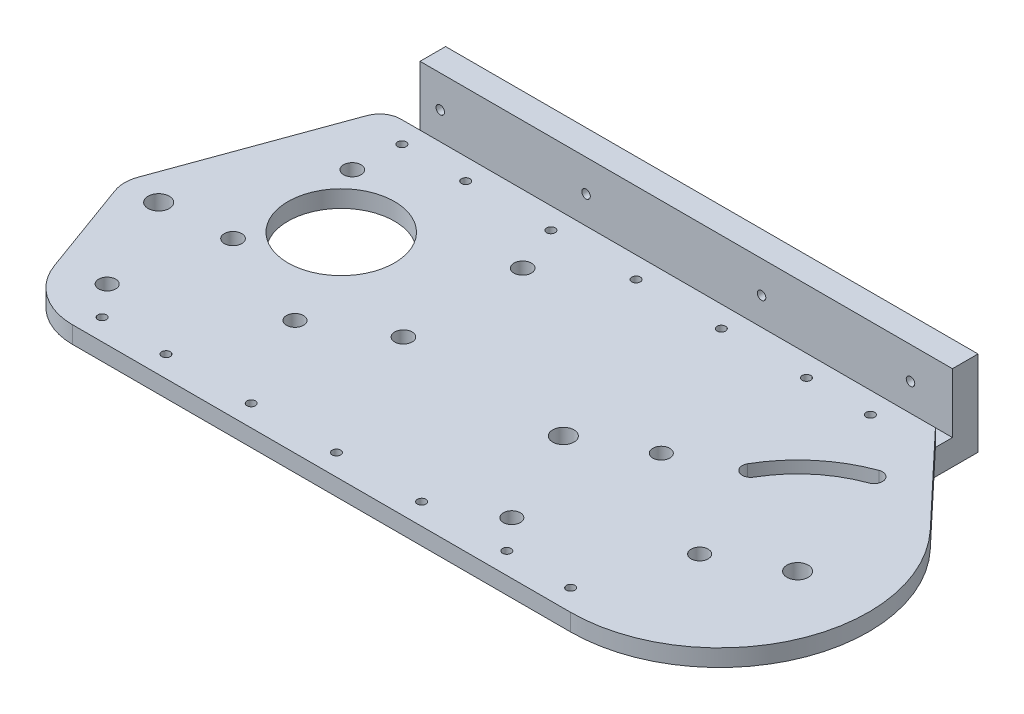
from build123d import *

# Parameters (mm, degrees)
SKETCH_1_R      = 2.5
SKETCH_1_R_2    = 2
SKETCH_1_R_3    = 2.05
SKETCH_1_R_4    = 12.5
SKETCH_1_R_5    = 1
EXTRUDE_1_DEPTH = 2
SCALE1_SCALE    = 2
EXTRUDE2_DEPTH  = 250
SKETCH5_R       = 2
EXTRUDE3_DEPTH  = 223.663658143
SKETCH6_R       = 2
EXTRUDE4_DEPTH  = 265.253658979


with BuildPart() as part:
    # 草图1 → 凸台-拉伸1 (new, symmetric)
    with BuildSketch(Plane(origin=(0, 0, 0), x_dir=(1, 0, 0), z_dir=(0, 1, 0))):
        with BuildLine():
            Line((-102.517540966, -2.736161147), (-94.366740219, -25.13030215))
            ThreePointArc((-94.366740219, -25.13030215), (-88.874997453, -32.287280664), (-80.271350907, -35))
            Line((-80.271350907, -35), (36.680057211, -35))
            ThreePointArc((36.680057211, -35), (68.818374627, -13.861044465), (62.135522738, 24.021225505))
            Line((62.135522738, 24.021225505), (42, 45.358983849))
            Line((42, 45.358983849), (-83.503064511, 45.358983849))
            ThreePointArc((-83.503064511, 45.358983849), (-86.370946693, 44.45474407), (-88.201527615, 42.069084565))
            Line((-88.201527615, 42.069084565), (-102.517540966, 2.736161147))
            ThreePointArc((-102.517540966, 2.736161147), (-103, 0), (-102.517540966, -2.736161147))
        make_face()
        with Locations(Location((-95, 0, 0), (0, 0, 270))):
            Circle(SKETCH_1_R, mode=Mode.SUBTRACT)
        with Locations(Location((0, 0, 0), (0, 0, 270))):
            Circle(SKETCH_1_R, mode=Mode.SUBTRACT)
        with Locations(Location((-84.434543456, -22.657694676, 0), (0, 0, 270))):
            Circle(SKETCH_1_R_2, mode=Mode.SUBTRACT)
        with Locations(Location((-78.9, 29.358983849, 0), (0, 0, 270))):
            Circle(SKETCH_1_R_3, mode=Mode.SUBTRACT)
        with Locations(Location((-38.9, 29.358983849, 0), (0, 0, 270))):
            Circle(SKETCH_1_R_3, mode=Mode.SUBTRACT)
        with Locations(Location((-55, -8, 0), (0, 0, 270))):
            Circle(SKETCH_1_R_2, mode=Mode.SUBTRACT)
        with Locations(Location((40, -8, 0), (0, 0, 270))):
            Circle(SKETCH_1_R_2, mode=Mode.SUBTRACT)
        with Locations(Location((-67.5, 15.358983849, 0), (0, 0, 270))):
            Circle(SKETCH_1_R_4, mode=Mode.SUBTRACT)
        with Locations(Location((-38.9, 1.358983849, 0), (0, 0, 270))):
            Circle(SKETCH_1_R_3, mode=Mode.SUBTRACT)
        with Locations(Location((-78.9, 1.358983849, 0), (0, 0, 270))):
            Circle(SKETCH_1_R_3, mode=Mode.SUBTRACT)
        with Locations(Location((55, 0, 0), (0, 0, 270))):
            Circle(SKETCH_1_R, mode=Mode.SUBTRACT)
        with Locations(Location((10.565456544, -22.657694676, 0), (0, 0, 270))):
            Circle(SKETCH_1_R_2, mode=Mode.SUBTRACT)
        with Locations(Location((15, 8, 0), (0, 0, 270))):
            Circle(SKETCH_1_R_2, mode=Mode.SUBTRACT)
        with Locations(Location((-78.271350907, -30, 0), (0, 0, 270))):
            Circle(SKETCH_1_R_5, mode=Mode.SUBTRACT)
        with Locations(Location((-43.271350907, -30, 0), (0, 0, 270))):
            Circle(SKETCH_1_R_5, mode=Mode.SUBTRACT)
        with Locations(Location((-3.271350907, -30, 0), (0, 0, 270))):
            Circle(SKETCH_1_R_5, mode=Mode.SUBTRACT)
        with Locations(Location((31.728649093, -30, 0), (0, 0, 270))):
            Circle(SKETCH_1_R_5, mode=Mode.SUBTRACT)
        with Locations(Location((-78.271350907, 40.358983849, 0), (0, 0, 270))):
            Circle(SKETCH_1_R_5, mode=Mode.SUBTRACT)
        with Locations(Location((-43.271350907, 40.358983849, 0), (0, 0, 270))):
            Circle(SKETCH_1_R_5, mode=Mode.SUBTRACT)
        with Locations(Location((-3.271350907, 40.358983849, 0), (0, 0, 270))):
            Circle(SKETCH_1_R_5, mode=Mode.SUBTRACT)
        with Locations(Location((31.728649093, 40.358983849, 0), (0, 0, 270))):
            Circle(SKETCH_1_R_5, mode=Mode.SUBTRACT)
        with Locations(Location((-63.271350907, -30, 0), (0, 0, 270))):
            Circle(SKETCH_1_R_5, mode=Mode.SUBTRACT)
        with Locations(Location((-23.271350907, -30, 0), (0, 0, 270))):
            Circle(SKETCH_1_R_5, mode=Mode.SUBTRACT)
        with Locations(Location((16.728649093, -30, 0), (0, 0, 270))):
            Circle(SKETCH_1_R_5, mode=Mode.SUBTRACT)
        with Locations(Location((-63.271350907, 40.358983849, 0), (0, 0, 270))):
            Circle(SKETCH_1_R_5, mode=Mode.SUBTRACT)
        with Locations(Location((-23.271350907, 40.358983849, 0), (0, 0, 270))):
            Circle(SKETCH_1_R_5, mode=Mode.SUBTRACT)
        with Locations(Location((16.728649093, 40.358983849, 0), (0, 0, 270))):
            Circle(SKETCH_1_R_5, mode=Mode.SUBTRACT)
        with BuildLine():
            ThreePointArc((45.423435987, 26.311393382), (46.618780942, 28.87481891), (44.055355414, 30.070163865))
            ThreePointArc((44.055355414, 30.070163865), (34.43079649, 24.51342218), (27.287187079, 16))
            ThreePointArc((27.287187079, 16), (28.019237886, 13.267949192), (30.751288694, 14))
            ThreePointArc((30.751288694, 14), (37.001946929, 21.449244407), (45.423435987, 26.311393382))
        make_face(mode=Mode.SUBTRACT)
    extrude(amount=EXTRUDE_1_DEPTH, both=True)


with BuildPart() as part_1:
    # Scale1: scaled about (-14.701770956, 0, -4.021706178)
    add(part.part.scale(SCALE1_SCALE).moved(Location((14.701770956, 0, 4.021706178))))

    # Sketch4 → Extrude2 (add)
    with BuildSketch(Plane(origin=(98.701770956, -4, -86.696261519), x_dir=(0, 0, 1), z_dir=(-1, 0, 0))):
        Polygon((-8, 0), (20, 0), (20, -12), (-20, -12), (-20, 28), (-8, 28), align=None)
    extrude(amount=EXTRUDE2_DEPTH)

    # Sketch5 → Extrude3 (cut, through all)
    with BuildSketch(Plane.XZ.offset(16)):
        with Locations(Location((8.159069141, -76.696261519, 0), (0, 0, 270))):
            Circle(SKETCH5_R)
        with Locations(Location((-71.840930859, -76.696261519, 0), (0, 0, 270))):
            Circle(SKETCH5_R)
        with Locations(Location((78.159069141, -76.696261519, 0), (0, 0, 270))):
            Circle(SKETCH5_R)
        with Locations(Location((-141.840930859, -76.696261519, 0), (0, 0, 270))):
            Circle(SKETCH5_R)
    extrude(amount=-EXTRUDE3_DEPTH, mode=Mode.SUBTRACT)

    # Sketch6 → Extrude4 (cut, through all)
    with BuildSketch(Plane(origin=(0, 0, -106.696261519), x_dir=(-1, 0, 0), z_dir=(0, 0, -1))):
        with Locations((-79.006277953, 9)):
            Circle(SKETCH6_R)
        with Locations((-9.059826494, 9)):
            Circle(SKETCH6_R)
        with Locations((73.343338498, 9)):
            Circle(SKETCH6_R)
        with Locations((141.789023619, 9)):
            Circle(SKETCH6_R)
    extrude(amount=-EXTRUDE4_DEPTH, mode=Mode.SUBTRACT)


solid = part_1.part
